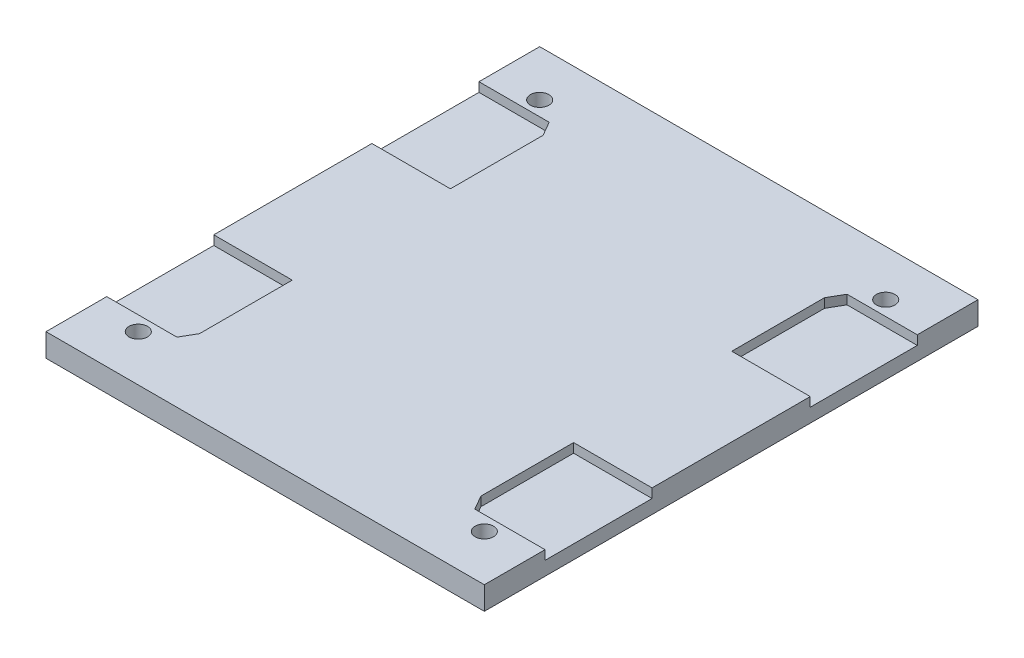
from build123d import *

# Parameters (mm, degrees)
SKETCH2_R           = 2
BOSS_EXTRUDE1_DEPTH = 5
CUT_EXTRUDE1_DEPTH  = 2


with BuildPart() as part:
    # Sketch2 → Boss-Extrude1 (new body)
    # profile 1 of 2: a face of its own
    with BuildSketch(Plane(origin=(0, 0, 0), x_dir=(1, 0, 0), z_dir=(0, 1, 0))):
        with BuildLine():
            ThreePointArc((37.5, -45.5), (36.085786438, -42.085786438), (39.5, -43.5))
            Line((39.5, -43.5), (47.5, -43.5))
            Line((47.5, -43.5), (47.5, 53.5))
            Line((47.5, 53.5), (-47.5, 53.5))
            Line((-47.5, 53.5), (-47.5, -53.5))
            Line((-47.5, -53.5), (37.5, -53.5))
            Line((37.5, -53.5), (37.5, -45.5))
        make_face()
        with Locations(Location((-37.5, -43.5, 0), (0, 0, 270))):
            Circle(SKETCH2_R, mode=Mode.SUBTRACT)
        with Locations(Location((-37.5, 43.5, 0), (0, 0, 270))):
            Circle(SKETCH2_R, mode=Mode.SUBTRACT)
        with Locations(Location((37.5, 43.5, 0), (0, 0, 270))):
            Circle(SKETCH2_R, mode=Mode.SUBTRACT)
    # profile 2 of 2: a face of its own
    with BuildSketch(Plane(origin=(0, 0, 0), x_dir=(1, 0, 0), z_dir=(0, 1, 0))):
        with BuildLine():
            Line((47.5, -43.5), (39.5, -43.5))
            ThreePointArc((39.5, -43.5), (38.914213562, -44.914213562), (37.5, -45.5))
            Line((37.5, -45.5), (37.5, -53.5))
            Line((37.5, -53.5), (47.5, -53.5))
            Line((47.5, -53.5), (47.5, -43.5))
        make_face()
    extrude(amount=BOSS_EXTRUDE1_DEPTH)

    # Sketch3 → Cut-Extrude1 (cut)
    with BuildSketch(Plane(origin=(0, 5, 0), x_dir=(1, 0, 0), z_dir=(0, 1, 0))):
        Polygon((-47.5, 40.237063088), (-47.5, 17.240159463), (-47.5, 17.140159463), (-30.489963443, 17.140159463), (-30.489963443, 37.232769094), (-32.282228416, 40.337063088), (-47.5, 40.337063088), align=None)
        Polygon((47.5, 40.337063088), (32.282228416, 40.337063088), (30.489963443, 37.232769094), (30.489963443, 17.140159463), (47.5, 17.140159463), (47.5, 17.240159463), (47.5, 40.237063088), align=None)
        Polygon((47.5, -17.240159463), (47.5, -17.140159463), (30.489963443, -17.140159463), (30.489963443, -37.232769094), (32.282228416, -40.337063088), (47.5, -40.337063088), (47.5, -40.237063088), align=None)
        Polygon((-30.489963443, -17.140159463), (-47.5, -17.140159463), (-47.5, -17.240159463), (-47.5, -40.237063088), (-47.5, -40.337063088), (-32.282228416, -40.337063088), (-30.489963443, -37.232769094), align=None)
    extrude(amount=-CUT_EXTRUDE1_DEPTH, mode=Mode.SUBTRACT)


solid = part.part
